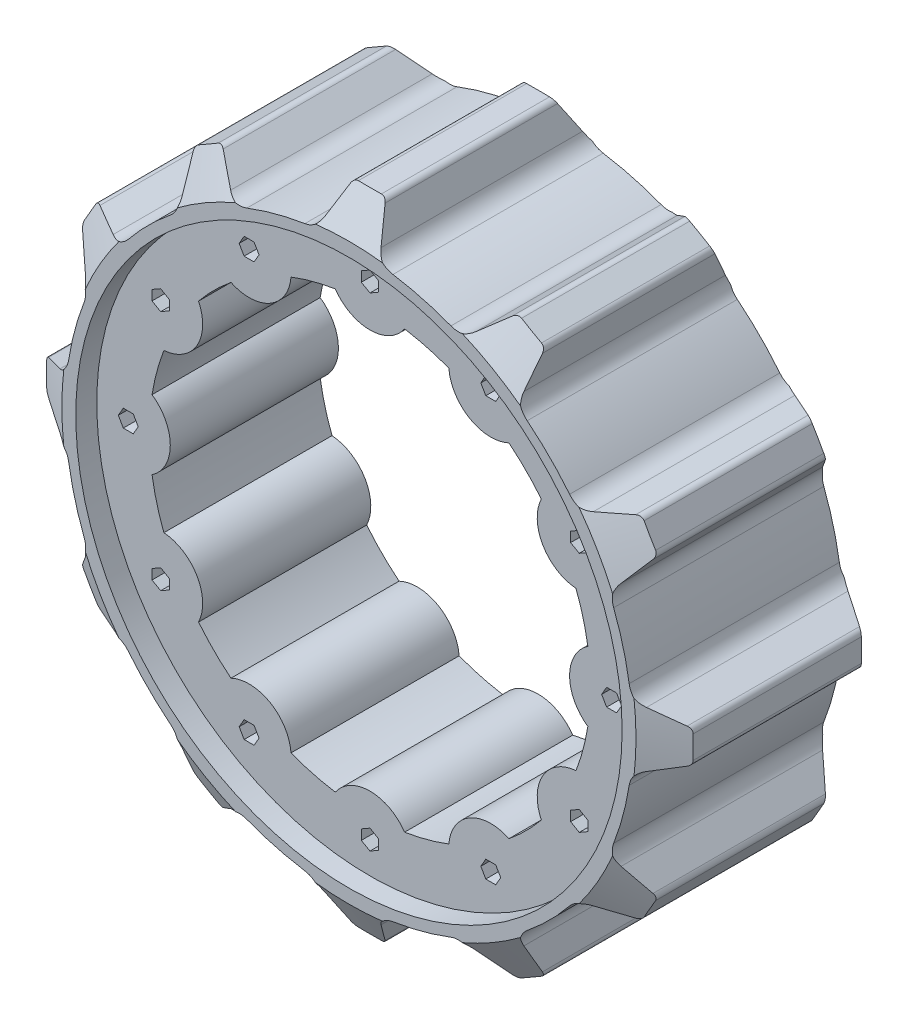
from build123d import *

# Parameters (mm, degrees)
SKETCH_1_R           = 130
SKETCH_1_R_2         = 105
EXTRUDE_1_DEPTH      = 80
CUT_EXTRUDE_1_DEPTH  = 201.499376558
EXTRUDE_2_DEPTH      = 10
EXTRUDE_2_DEPTH_BACK = 90
SKETCH_5_R           = 150
SKETCH_5_R_2         = 130
EXTRUDE_3_DEPTH      = 80
EXTRUDE_4_DEPTH      = 100
CUT_EXTRUDE_4_DEPTH  = 240.414228959
FILLET_2_R           = 10
FILLET_3_R           = 3


with BuildPart() as part:
    # 草图1 → 凸台-拉伸1 (new body)
    with BuildSketch(Plane.XY):
        Circle(SKETCH_1_R)
        Circle(SKETCH_1_R_2, mode=Mode.SUBTRACT)
    extrude(amount=EXTRUDE_1_DEPTH)

    # 草图2 → 切除-拉伸1 (cut, through all)
    with BuildSketch(Plane.XY.offset(80)):
        Polygon((62.234272207, 99.592921435), (59.867136104, 103.692921435), (55.132863896, 103.692921435), (52.765727793, 99.592921435), (55.132863896, 95.492921435), (59.867136104, 95.492921435), align=None)
        Polygon((4.1, 117.367136104), (0, 119.734272207), (-4.1, 117.367136104), (-4.1, 112.632863896), (0, 110.265727793), (4.1, 112.632863896), align=None)
        Polygon((103.692921435, 55.132863896), (103.692921435, 59.867136104), (99.592921435, 62.234272207), (95.492921435, 59.867136104), (95.492921435, 55.132863896), (99.592921435, 52.765727793), align=None)
        Polygon((117.367136104, -4.1), (119.734272207, 0), (117.367136104, 4.1), (112.632863896, 4.1), (110.265727793, 0), (112.632863896, -4.1), align=None)
        Polygon((99.592921435, -62.234272207), (103.692921435, -59.867136104), (103.692921435, -55.132863896), (99.592921435, -52.765727793), (95.492921435, -55.132863896), (95.492921435, -59.867136104), align=None)
        Polygon((55.132863896, -103.692921435), (59.867136104, -103.692921435), (62.234272207, -99.592921435), (59.867136104, -95.492921435), (55.132863896, -95.492921435), (52.765727793, -99.592921435), align=None)
        Polygon((-4.1, -117.367136104), (0, -119.734272207), (4.1, -117.367136104), (4.1, -112.632863896), (0, -110.265727793), (-4.1, -112.632863896), align=None)
        Polygon((-62.234272207, -99.592921435), (-59.867136104, -103.692921435), (-55.132863896, -103.692921435), (-52.765727793, -99.592921435), (-55.132863896, -95.492921435), (-59.867136104, -95.492921435), align=None)
        Polygon((-103.692921435, -55.132863896), (-103.692921435, -59.867136104), (-99.592921435, -62.234272207), (-95.492921435, -59.867136104), (-95.492921435, -55.132863896), (-99.592921435, -52.765727793), align=None)
        Polygon((-117.367136104, 4.1), (-119.734272207, 0), (-117.367136104, -4.1), (-112.632863896, -4.1), (-110.265727793, 0), (-112.632863896, 4.1), align=None)
        Polygon((-99.592921435, 62.234272207), (-103.692921435, 59.867136104), (-103.692921435, 55.132863896), (-99.592921435, 52.765727793), (-95.492921435, 55.132863896), (-95.492921435, 59.867136104), align=None)
        Polygon((-55.132863896, 103.692921435), (-59.867136104, 103.692921435), (-62.234272207, 99.592921435), (-59.867136104, 95.492921435), (-55.132863896, 95.492921435), (-52.765727793, 99.592921435), align=None)
    extrude(amount=-CUT_EXTRUDE_1_DEPTH, mode=Mode.SUBTRACT)

    # 草图5 → 凸台-拉伸2 (add, two sides: drawn at the far end of the back side and taken through both)
    with BuildSketch(Plane.XY.offset(80).offset(-EXTRUDE_2_DEPTH_BACK)):
        Circle(SKETCH_5_R)
        Circle(SKETCH_5_R_2, mode=Mode.SUBTRACT)
    extrude(amount=EXTRUDE_2_DEPTH + EXTRUDE_2_DEPTH_BACK)

    # 草图7 → 凸台-拉伸3 (add)
    with BuildSketch(Plane.XY.offset(80)):
        with BuildLine():
            Line((-20, 115), (-7.5, 115))
            ThreePointArc((-7.5, 115), (0, 107.5), (7.5, 115))
            Line((7.5, 115), (20, 115))
            ThreePointArc((20, 115), (0, 95), (-20, 115))
        make_face()
        with BuildLine():
            Line((40.179491924, 109.592921435), (51.004809472, 103.342921435))
            ThreePointArc((51.004809472, 103.342921435), (53.75, 93.097730907), (63.995190528, 95.842921435))
            Line((63.995190528, 95.842921435), (74.820508076, 89.592921435))
            ThreePointArc((74.820508076, 89.592921435), (47.5, 82.27241336), (40.179491924, 109.592921435))
        make_face()
        with BuildLine():
            Line((89.592921435, 74.820508076), (95.842921435, 63.995190528))
            ThreePointArc((95.842921435, 63.995190528), (93.097730907, 53.75), (103.342921435, 51.004809472))
            Line((103.342921435, 51.004809472), (109.592921435, 40.179491924))
            ThreePointArc((109.592921435, 40.179491924), (82.27241336, 47.5), (89.592921435, 74.820508076))
        make_face()
        with BuildLine():
            Line((115, 20), (115, 7.5))
            ThreePointArc((115, 7.5), (107.5, 0), (115, -7.5))
            Line((115, -7.5), (115, -20))
            ThreePointArc((115, -20), (95, 0), (115, 20))
        make_face()
        with BuildLine():
            Line((109.592921435, -40.179491924), (103.342921435, -51.004809472))
            ThreePointArc((103.342921435, -51.004809472), (93.097730907, -53.75), (95.842921435, -63.995190528))
            Line((95.842921435, -63.995190528), (89.592921435, -74.820508076))
            ThreePointArc((89.592921435, -74.820508076), (82.27241336, -47.5), (109.592921435, -40.179491924))
        make_face()
        with BuildLine():
            Line((74.820508076, -89.592921435), (63.995190528, -95.842921435))
            ThreePointArc((63.995190528, -95.842921435), (53.75, -93.097730907), (51.004809472, -103.342921435))
            Line((51.004809472, -103.342921435), (40.179491924, -109.592921435))
            ThreePointArc((40.179491924, -109.592921435), (47.5, -82.27241336), (74.820508076, -89.592921435))
        make_face()
        with BuildLine():
            Line((20, -115), (7.5, -115))
            ThreePointArc((7.5, -115), (0, -107.5), (-7.5, -115))
            Line((-7.5, -115), (-20, -115))
            ThreePointArc((-20, -115), (0, -95), (20, -115))
        make_face()
        with BuildLine():
            Line((-40.179491924, -109.592921435), (-51.004809472, -103.342921435))
            ThreePointArc((-51.004809472, -103.342921435), (-53.75, -93.097730907), (-63.995190528, -95.842921435))
            Line((-63.995190528, -95.842921435), (-74.820508076, -89.592921435))
            ThreePointArc((-74.820508076, -89.592921435), (-47.5, -82.27241336), (-40.179491924, -109.592921435))
        make_face()
        with BuildLine():
            Line((-89.592921435, -74.820508076), (-95.842921435, -63.995190528))
            ThreePointArc((-95.842921435, -63.995190528), (-93.097730907, -53.75), (-103.342921435, -51.004809472))
            Line((-103.342921435, -51.004809472), (-109.592921435, -40.179491924))
            ThreePointArc((-109.592921435, -40.179491924), (-82.27241336, -47.5), (-89.592921435, -74.820508076))
        make_face()
        with BuildLine():
            Line((-115, -20), (-115, -7.5))
            ThreePointArc((-115, -7.5), (-107.5, 0), (-115, 7.5))
            Line((-115, 7.5), (-115, 20))
            ThreePointArc((-115, 20), (-95, 0), (-115, -20))
        make_face()
        with BuildLine():
            Line((-109.592921435, 40.179491924), (-103.342921435, 51.004809472))
            ThreePointArc((-103.342921435, 51.004809472), (-93.097730907, 53.75), (-95.842921435, 63.995190528))
            Line((-95.842921435, 63.995190528), (-89.592921435, 74.820508076))
            ThreePointArc((-89.592921435, 74.820508076), (-82.27241336, 47.5), (-109.592921435, 40.179491924))
        make_face()
        with BuildLine():
            Line((-74.820508076, 89.592921435), (-63.995190528, 95.842921435))
            ThreePointArc((-63.995190528, 95.842921435), (-53.75, 93.097730907), (-51.004809472, 103.342921435))
            Line((-51.004809472, 103.342921435), (-40.179491924, 109.592921435))
            ThreePointArc((-40.179491924, 109.592921435), (-47.5, 82.27241336), (-74.820508076, 89.592921435))
        make_face()
    extrude(amount=-EXTRUDE_3_DEPTH)

    # 草图8 → 凸台-拉伸4 (add, through all)
    with BuildSketch(Plane.XY.offset(90)):
        with BuildLine():
            Line((-7.5, 153.81673028), (-9.138136324, 149.721389469))
            ThreePointArc((-9.138136324, 149.721389469), (0, 150), (9.138136324, 149.721389469))
            Line((9.138136324, 149.721389469), (7.5, 153.81673028))
            Line((7.5, 153.81673028), (-7.5, 153.81673028))
        make_face()
        with BuildLine():
            ThreePointArc((-82.774552935, 125.093458608), (-75, 129.903810568), (-66.946836534, 134.231594932))
            Line((-66.946836534, 134.231594932), (-70.413174612, 136.959195949))
            Line((-70.413174612, 136.959195949), (-83.403555668, 129.459195949))
            Line((-83.403555668, 129.459195949), (-82.774552935, 125.093458608))
        make_face()
        with BuildLine():
            Line((70.413174612, 136.959195949), (66.946836534, 134.231594932))
            ThreePointArc((66.946836534, 134.231594932), (75, 129.903810568), (82.774552935, 125.093458608))
            Line((82.774552935, 125.093458608), (83.403555668, 129.459195949))
            Line((83.403555668, 129.459195949), (70.413174612, 136.959195949))
        make_face()
        with BuildLine():
            ThreePointArc((-134.231594932, 66.946836534), (-129.903810568, 75), (-125.093458608, 82.774552935))
            Line((-125.093458608, 82.774552935), (-129.459195949, 83.403555668))
            Line((-129.459195949, 83.403555668), (-136.959195949, 70.413174612))
            Line((-136.959195949, 70.413174612), (-134.231594932, 66.946836534))
        make_face()
        with BuildLine():
            Line((129.459195949, 83.403555668), (125.093458608, 82.774552935))
            ThreePointArc((125.093458608, 82.774552935), (129.903810568, 75), (134.231594932, 66.946836534))
            Line((134.231594932, 66.946836534), (136.959195949, 70.413174612))
            Line((136.959195949, 70.413174612), (129.459195949, 83.403555668))
        make_face()
        with BuildLine():
            ThreePointArc((-149.721389469, -9.138136324), (-150, 0), (-149.721389469, 9.138136324))
            Line((-149.721389469, 9.138136324), (-153.81673028, 7.5))
            Line((-153.81673028, 7.5), (-153.81673028, -7.5))
            Line((-153.81673028, -7.5), (-149.721389469, -9.138136324))
        make_face()
        with BuildLine():
            Line((153.81673028, 7.5), (149.721389469, 9.138136324))
            ThreePointArc((149.721389469, 9.138136324), (150, 0), (149.721389469, -9.138136324))
            Line((149.721389469, -9.138136324), (153.81673028, -7.5))
            Line((153.81673028, -7.5), (153.81673028, 7.5))
        make_face()
        with BuildLine():
            ThreePointArc((-125.093458608, -82.774552935), (-129.903810568, -75), (-134.231594932, -66.946836534))
            Line((-134.231594932, -66.946836534), (-136.959195949, -70.413174612))
            Line((-136.959195949, -70.413174612), (-129.459195949, -83.403555668))
            Line((-129.459195949, -83.403555668), (-125.093458608, -82.774552935))
        make_face()
        with BuildLine():
            ThreePointArc((-66.946836534, -134.231594932), (-75, -129.903810568), (-82.774552935, -125.093458608))
            Line((-82.774552935, -125.093458608), (-83.403555668, -129.459195949))
            Line((-83.403555668, -129.459195949), (-70.413174612, -136.959195949))
            Line((-70.413174612, -136.959195949), (-66.946836534, -134.231594932))
        make_face()
        with BuildLine():
            Line((136.959195949, -70.413174612), (134.231594932, -66.946836534))
            ThreePointArc((134.231594932, -66.946836534), (129.903810568, -75), (125.093458608, -82.774552935))
            Line((125.093458608, -82.774552935), (129.459195949, -83.403555668))
            Line((129.459195949, -83.403555668), (136.959195949, -70.413174612))
        make_face()
        with BuildLine():
            ThreePointArc((9.138136324, -149.721389469), (0, -150), (-9.138136324, -149.721389469))
            Line((-9.138136324, -149.721389469), (-7.5, -153.81673028))
            Line((-7.5, -153.81673028), (7.5, -153.81673028))
            Line((7.5, -153.81673028), (9.138136324, -149.721389469))
        make_face()
        with BuildLine():
            Line((83.403555668, -129.459195949), (82.774552935, -125.093458608))
            ThreePointArc((82.774552935, -125.093458608), (75, -129.903810568), (66.946836534, -134.231594932))
            Line((66.946836534, -134.231594932), (70.413174612, -136.959195949))
            Line((70.413174612, -136.959195949), (83.403555668, -129.459195949))
        make_face()
    extrude(amount=-EXTRUDE_4_DEPTH)

    # 草图10 → 切除-拉伸4 (cut, through all)
    with BuildSketch(Plane.XY.offset(90)):
        with BuildLine():
            Line((-9.138136324, 149.721389469), (-15.378189759, 134.121255883))
            ThreePointArc((-15.378189759, 134.121255883), (-34.940571089, 130.399986549), (-53.742724947, 123.841509662))
            Line((-53.742724947, 123.841509662), (-66.946836534, 134.231594932))
            ThreePointArc((-66.946836534, 134.231594932), (-38.822856765, 144.888873943), (-9.138136324, 149.721389469))
        make_face()
        with BuildLine():
            Line((9.138136324, 149.721389469), (15.378189759, 134.121255883))
            ThreePointArc((15.378189759, 134.121255883), (34.940571089, 130.399986549), (53.742724947, 123.841509662))
            Line((53.742724947, 123.841509662), (66.946836534, 134.231594932))
            ThreePointArc((66.946836534, 134.231594932), (38.822856765, 144.888873943), (9.138136324, 149.721389469))
        make_face()
        with BuildLine():
            Line((82.774552935, 125.093458608), (80.378530937, 108.463319903))
            ThreePointArc((80.378530937, 108.463319903), (95.45941546, 95.45941546), (108.463319903, 80.378530937))
            Line((108.463319903, 80.378530937), (125.093458608, 82.774552935))
            ThreePointArc((125.093458608, 82.774552935), (106.066017178, 106.066017178), (82.774552935, 125.093458608))
        make_face()
        with BuildLine():
            Line((134.231594932, 66.946836534), (123.841509662, 53.742724947))
            ThreePointArc((123.841509662, 53.742724947), (130.399986549, 34.940571089), (134.121255883, 15.378189759))
            Line((134.121255883, 15.378189759), (149.721389469, 9.138136324))
            ThreePointArc((149.721389469, 9.138136324), (144.888873943, 38.822856765), (134.231594932, 66.946836534))
        make_face()
        with BuildLine():
            Line((149.721389469, -9.138136324), (134.121255883, -15.378189759))
            ThreePointArc((134.121255883, -15.378189759), (130.399986549, -34.940571089), (123.841509662, -53.742724947))
            Line((123.841509662, -53.742724947), (134.231594932, -66.946836534))
            ThreePointArc((134.231594932, -66.946836534), (144.888873943, -38.822856765), (149.721389469, -9.138136324))
        make_face()
        with BuildLine():
            Line((125.093458608, -82.774552935), (108.463319903, -80.378530937))
            ThreePointArc((108.463319903, -80.378530937), (95.45941546, -95.45941546), (80.378530937, -108.463319903))
            Line((80.378530937, -108.463319903), (82.774552935, -125.093458608))
            ThreePointArc((82.774552935, -125.093458608), (106.066017178, -106.066017178), (125.093458608, -82.774552935))
        make_face()
        with BuildLine():
            Line((66.946836534, -134.231594932), (53.742724947, -123.841509662))
            ThreePointArc((53.742724947, -123.841509662), (34.940571089, -130.399986549), (15.378189759, -134.121255883))
            Line((15.378189759, -134.121255883), (9.138136324, -149.721389469))
            ThreePointArc((9.138136324, -149.721389469), (38.822856765, -144.888873943), (66.946836534, -134.231594932))
        make_face()
        with BuildLine():
            Line((-9.138136324, -149.721389469), (-15.378189759, -134.121255883))
            ThreePointArc((-15.378189759, -134.121255883), (-34.940571089, -130.399986549), (-53.742724947, -123.841509662))
            Line((-53.742724947, -123.841509662), (-66.946836534, -134.231594932))
            ThreePointArc((-66.946836534, -134.231594932), (-38.822856765, -144.888873943), (-9.138136324, -149.721389469))
        make_face()
        with BuildLine():
            Line((-82.774552935, -125.093458608), (-80.378530937, -108.463319903))
            ThreePointArc((-80.378530937, -108.463319903), (-95.45941546, -95.45941546), (-108.463319903, -80.378530937))
            Line((-108.463319903, -80.378530937), (-125.093458608, -82.774552935))
            ThreePointArc((-125.093458608, -82.774552935), (-106.066017178, -106.066017178), (-82.774552935, -125.093458608))
        make_face()
        with BuildLine():
            Line((-134.231594932, -66.946836534), (-123.841509662, -53.742724947))
            ThreePointArc((-123.841509662, -53.742724947), (-130.399986549, -34.940571089), (-134.121255883, -15.378189759))
            Line((-134.121255883, -15.378189759), (-149.721389469, -9.138136324))
            ThreePointArc((-149.721389469, -9.138136324), (-144.888873943, -38.822856765), (-134.231594932, -66.946836534))
        make_face()
        with BuildLine():
            Line((-149.721389469, 9.138136324), (-134.121255883, 15.378189759))
            ThreePointArc((-134.121255883, 15.378189759), (-130.399986549, 34.940571089), (-123.841509662, 53.742724947))
            Line((-123.841509662, 53.742724947), (-134.231594932, 66.946836534))
            ThreePointArc((-134.231594932, 66.946836534), (-144.888873943, 38.822856765), (-149.721389469, 9.138136324))
        make_face()
        with BuildLine():
            Line((-125.093458608, 82.774552935), (-108.463319903, 80.378530937))
            ThreePointArc((-108.463319903, 80.378530937), (-95.45941546, 95.45941546), (-80.378530937, 108.463319903))
            Line((-80.378530937, 108.463319903), (-82.774552935, 125.093458608))
            ThreePointArc((-82.774552935, 125.093458608), (-106.066017178, 106.066017178), (-125.093458608, 82.774552935))
        make_face()
    extrude(amount=-CUT_EXTRUDE_4_DEPTH, mode=Mode.SUBTRACT)

    # 圆角2
    fillet_2_edges = [part.edges().sort_by_distance(p)[0] for p in [
        (-80.378530937, 108.463319903, 40),
        (-108.463319903, 80.378530937, 40),
        (53.742724947, 123.841509662, 40),
        (15.378189759, 134.121255883, 40),
        (-123.841509662, 53.742724947, 40),
        (-134.121255883, 15.378189759, 40),
        (108.463319903, 80.378530937, 40),
        (80.378530937, 108.463319903, 40),
        (-53.742724947, -123.841509662, 40),
        (-15.378189759, -134.121255883, 40),
        (-108.463319903, -80.378530937, 40),
        (-80.378530937, -108.463319903, 40),
        (-134.121255883, -15.378189759, 40),
        (-123.841509662, -53.742724947, 40),
        (-15.378189759, 134.121255883, 40),
        (-53.742724947, 123.841509662, 40),
        (15.378189759, -134.121255883, 40),
        (53.742724947, -123.841509662, 40),
        (80.378530937, -108.463319903, 40),
        (108.463319903, -80.378530937, 40),
        (123.841509662, -53.742724947, 40),
        (134.121255883, -15.378189759, 40),
        (134.121255883, 15.378189759, 40),
        (123.841509662, 53.742724947, 40),
    ]]
    fillet(fillet_2_edges, radius=FILLET_2_R)

    # 圆角3
    fillet_3_edges = [part.edges().sort_by_distance(p)[0] for p in [
        (-153.81673028, -7.5, 40),
        (-153.81673028, 7.5, 40),
        (-136.959195949, 70.413174612, 40),
        (-129.459195949, 83.403555668, 40),
        (-83.403555668, 129.459195949, 40),
        (-70.413174612, 136.959195949, 40),
        (-7.5, 153.81673028, 40),
        (7.5, 153.81673028, 40),
        (70.413174612, 136.959195949, 40),
        (83.403555668, 129.459195949, 40),
        (129.459195949, 83.403555668, 40),
        (136.959195949, 70.413174612, 40),
        (153.81673028, 7.5, 40),
        (153.81673028, -7.5, 40),
        (136.959195949, -70.413174612, 40),
        (129.459195949, -83.403555668, 40),
        (83.403555668, -129.459195949, 40),
        (70.413174612, -136.959195949, 40),
        (7.5, -153.81673028, 40),
        (-7.5, -153.81673028, 40),
        (-70.413174612, -136.959195949, 40),
        (-83.403555668, -129.459195949, 40),
        (-129.459195949, -83.403555668, 40),
        (-136.959195949, -70.413174612, 40),
    ]]
    fillet(fillet_3_edges, radius=FILLET_3_R)

    # 草图11 → 切除-旋转4 (revolve, cut)
    with BuildSketch(Plane(origin=(0, 0, 0), x_dir=(1, 0, 0), z_dir=(0, 1, 0))):
        Polygon((-50, 60), (-160, -3.508529611), (-160, 60), align=None)
        Polygon((-160, -140), (-160, -76.491470389), (-50, -140), align=None)
    revolve(axis=Axis((0, 0, 0), (0, 0, -1)), mode=Mode.SUBTRACT)


solid = part.part
